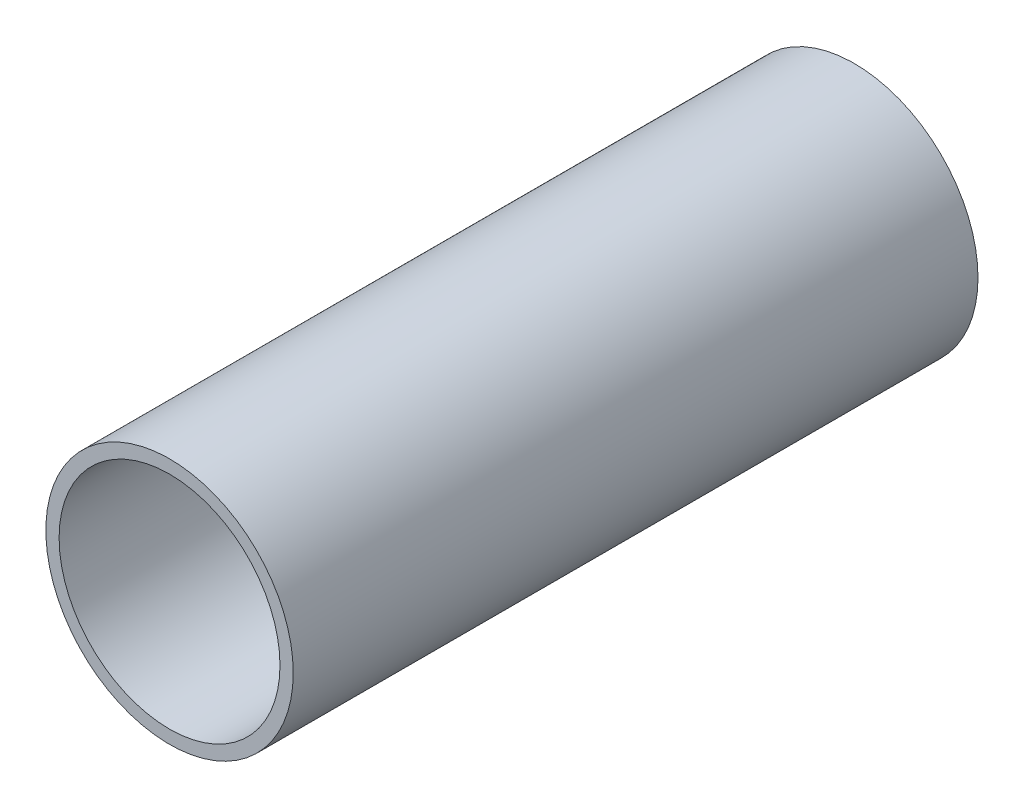
from build123d import *

# Parameters (mm, degrees)
SKETCH1_R           = 56
BOSS_EXTRUDE1_DEPTH = 310
SKETCH2_R           = 50
CUT_EXTRUDE1_DEPTH  = 310


with BuildPart() as part:
    # Sketch1 → Boss-Extrude1 (new body)
    with BuildSketch(Plane.XY):
        Circle(SKETCH1_R)
    extrude(amount=BOSS_EXTRUDE1_DEPTH)

    # Sketch2 → Cut-Extrude1 (cut)
    with BuildSketch(Plane.XY.offset(310)):
        Circle(SKETCH2_R)
    extrude(amount=-CUT_EXTRUDE1_DEPTH, mode=Mode.SUBTRACT)


solid = part.part
